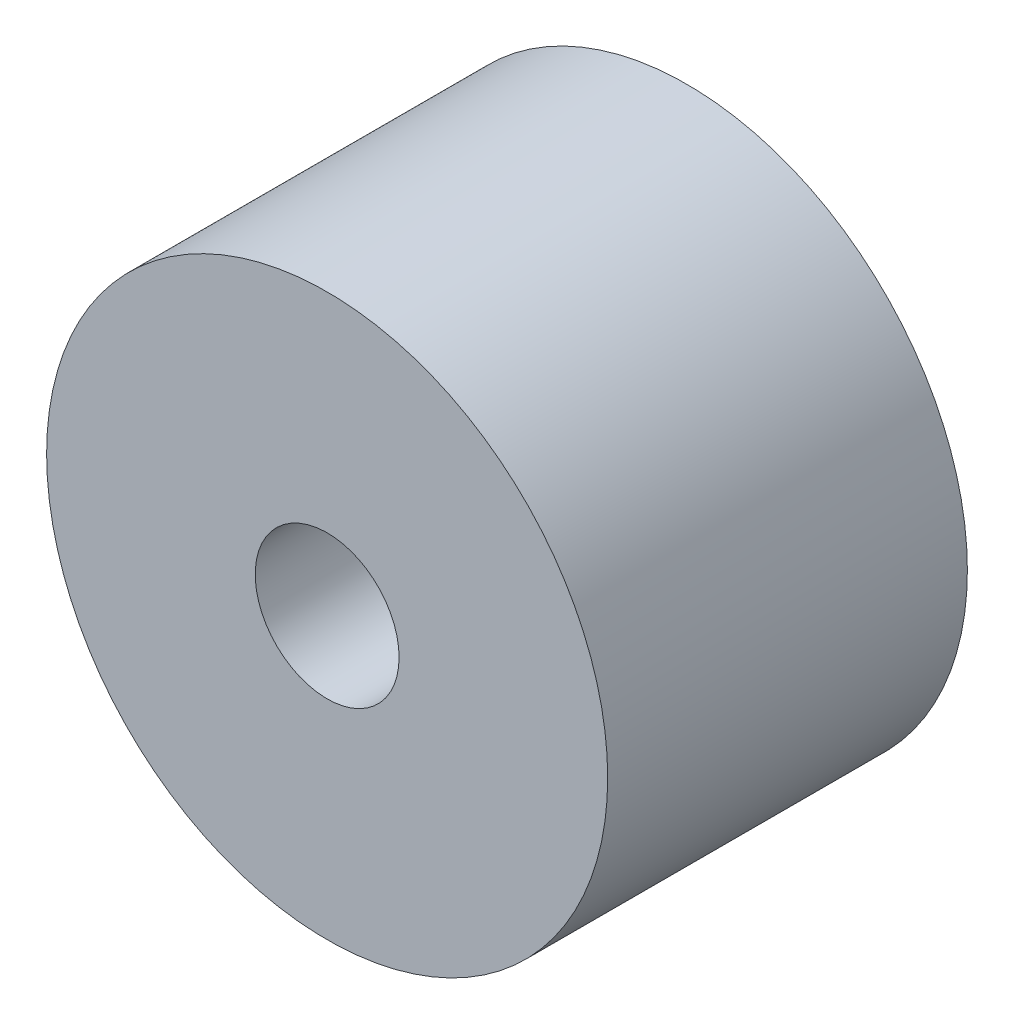
from build123d import *

# Parameters (mm, degrees)
SKETCH1_R           = 19.5
BOSS_EXTRUDE1_DEPTH = 12.5
SKETCH2_R           = 5
CUT_EXTRUDE1_DEPTH  = 32


with BuildPart() as part:
    # Sketch1 → Boss-Extrude1 (new, symmetric)
    with BuildSketch(Plane.XY):
        Circle(SKETCH1_R)
    extrude(amount=BOSS_EXTRUDE1_DEPTH, both=True)

    # Sketch2 → Cut-Extrude1 (cut)
    with BuildSketch(Plane.XY.offset(12.5)):
        Circle(SKETCH2_R)
    extrude(amount=-CUT_EXTRUDE1_DEPTH, mode=Mode.SUBTRACT)


solid = part.part
